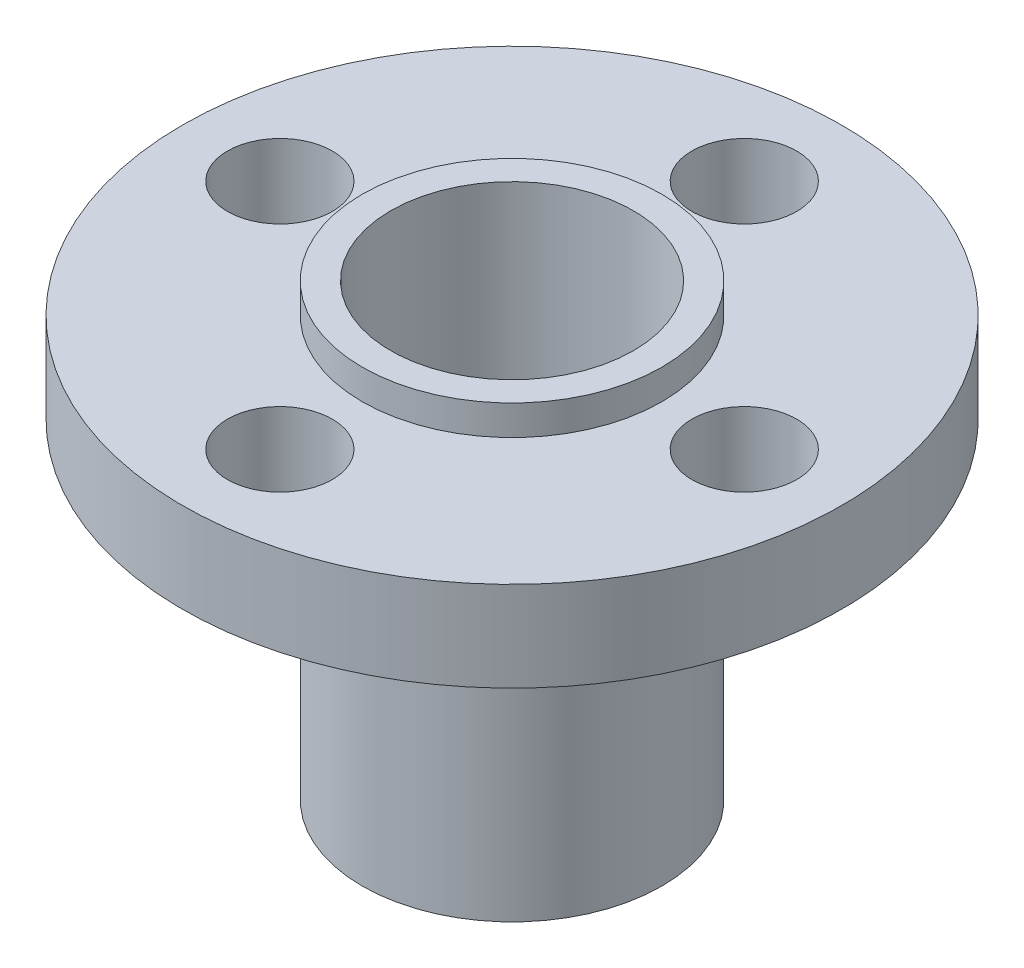
from build123d import *

# Parameters (mm, degrees)
KES_EKSTR_ZYON1_REACH = 23.61
IZIM2_R               = 4.05
KES_EKSTR_ZYON2_REACH = 22.928
IZIM3_R               = 1.75


with BuildPart() as part:
    # Çizim1 → Döndür1 (revolve)
    with BuildSketch(Plane.XY, mode=Mode.PRIVATE) as d_nd_r1_sk:
        Polygon((0, 6.572949203), (5, 6.572949203), (5, 5.572949203), (11, 5.572949203), (11, 2.572949203), (5, 2.572949203), (5, -8.427050797), (0, -8.427050797), align=None)
    revolve(d_nd_r1_sk.sketch.rotate(Axis((0, 6.572949203, 0), (0, -1, 0)), 180), axis=Axis((0, 6.572949203, 0), (0, -1, 0)))

    # Çizim2 → Kes-Ekstrüzyon1 (cut, up to next)
    with BuildSketch(Plane(origin=(0, 6.572949203, 0), x_dir=(1, 0, 0), z_dir=(0, 1, 0)), mode=Mode.PRIVATE) as kes_ekstr_zyon1_sk1:
        with Locations(Location((0, 0, 0), (0, 0, 180))):
            Circle(IZIM2_R)
    kes_ekstr_zyon1_tool1 = extrude(kes_ekstr_zyon1_sk1.sketch, amount=-KES_EKSTR_ZYON1_REACH, mode=Mode.PRIVATE) & part.part
    add(kes_ekstr_zyon1_tool1.solids().sort_by_distance((0, 6.572949, 0))[0], mode=Mode.SUBTRACT)

    # Çizim3 → Kes-Ekstrüzyon2 (cut, up to next)
    with BuildSketch(Plane(origin=(0, 5.572949203, 0), x_dir=(1, 0, 0), z_dir=(0, 1, 0)), mode=Mode.PRIVATE) as kes_ekstr_zyon2_sk1:
        with Locations(Location((0, 7.75, 0), (0, 0, 180))):
            Circle(IZIM3_R)
    kes_ekstr_zyon2_tool1 = extrude(kes_ekstr_zyon2_sk1.sketch, amount=-KES_EKSTR_ZYON2_REACH, mode=Mode.PRIVATE) & part.part
    # Çizim3 → Kes-Ekstrüzyon2 (cut, up to next)
    with BuildSketch(Plane(origin=(0, 5.572949203, 0), x_dir=(1, 0, 0), z_dir=(0, 1, 0)), mode=Mode.PRIVATE) as kes_ekstr_zyon2_sk2:
        with Locations(Location((7.75, 0, 0), (0, 0, 180))):
            Circle(IZIM3_R)
    kes_ekstr_zyon2_tool2 = extrude(kes_ekstr_zyon2_sk2.sketch, amount=-KES_EKSTR_ZYON2_REACH, mode=Mode.PRIVATE) & part.part
    # Çizim3 → Kes-Ekstrüzyon2 (cut, up to next)
    with BuildSketch(Plane(origin=(0, 5.572949203, 0), x_dir=(1, 0, 0), z_dir=(0, 1, 0)), mode=Mode.PRIVATE) as kes_ekstr_zyon2_sk3:
        with Locations(Location((0, -7.75, 0), (0, 0, 180))):
            Circle(IZIM3_R)
    kes_ekstr_zyon2_tool3 = extrude(kes_ekstr_zyon2_sk3.sketch, amount=-KES_EKSTR_ZYON2_REACH, mode=Mode.PRIVATE) & part.part
    # Çizim3 → Kes-Ekstrüzyon2 (cut, up to next)
    with BuildSketch(Plane(origin=(0, 5.572949203, 0), x_dir=(1, 0, 0), z_dir=(0, 1, 0)), mode=Mode.PRIVATE) as kes_ekstr_zyon2_sk4:
        with Locations(Location((-7.75, 0, 0), (0, 0, 180))):
            Circle(IZIM3_R)
    kes_ekstr_zyon2_tool4 = extrude(kes_ekstr_zyon2_sk4.sketch, amount=-KES_EKSTR_ZYON2_REACH, mode=Mode.PRIVATE) & part.part
    add(kes_ekstr_zyon2_tool1.solids().sort_by_distance((0, 5.572949, -7.75))[0], mode=Mode.SUBTRACT)
    add(kes_ekstr_zyon2_tool2.solids().sort_by_distance((7.75, 5.572949, 0))[0], mode=Mode.SUBTRACT)
    add(kes_ekstr_zyon2_tool3.solids().sort_by_distance((0, 5.572949, 7.75))[0], mode=Mode.SUBTRACT)
    add(kes_ekstr_zyon2_tool4.solids().sort_by_distance((-7.75, 5.572949, 0))[0], mode=Mode.SUBTRACT)


solid = part.part
